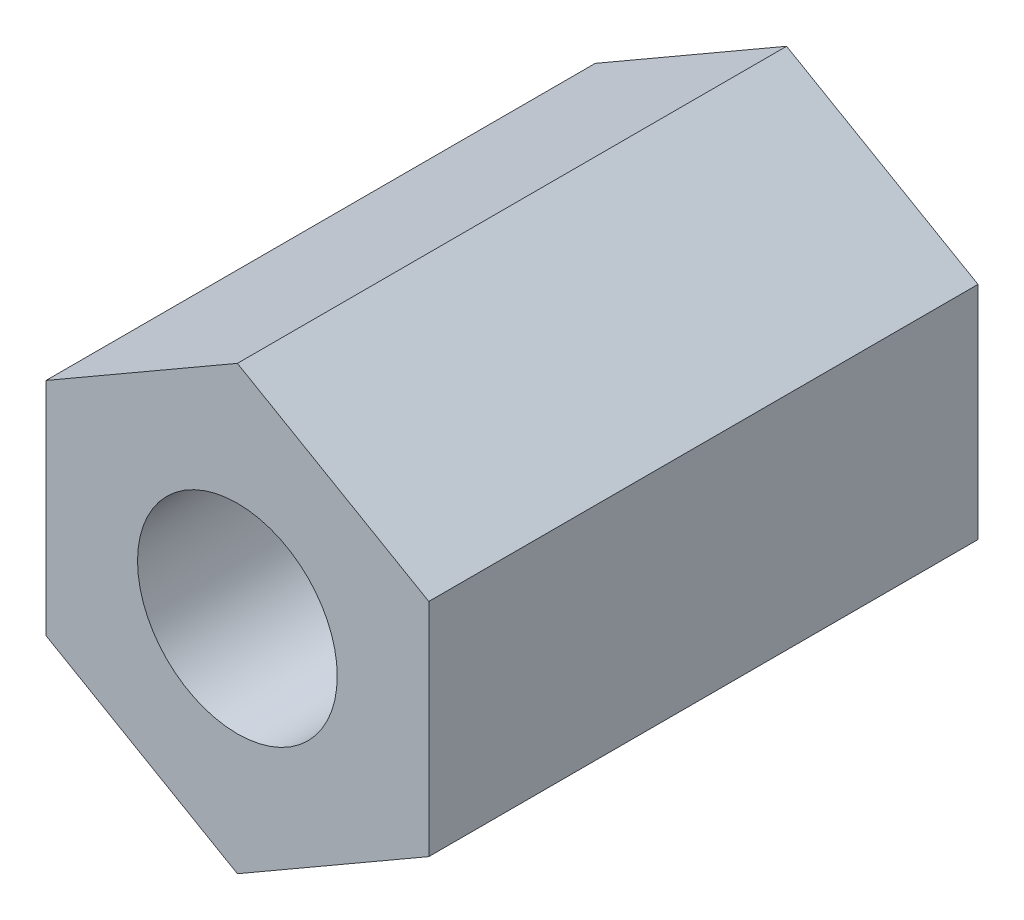
from build123d import *

# Parameters (mm, degrees)
EXTRUDE_1_DEPTH     = 66
SKETCH_12_R         = 15
CUT_EXTRUDE_3_DEPTH = 40
SKETCH_16_R         = 15
CUT_EXTRUDE_6_DEPTH = 4
CUT_EXTRUDE_6_DRAFT = -25
SKETCH_17_R         = 13.134769367
CUT_EXTRUDE_7_DEPTH = 2
CUT_EXTRUDE_7_DRAFT = -40
SKETCH_18_R         = 12
CUT_EXTRUDE_8_DEPTH = 22


with BuildPart() as part:
    # 草图2 → 拉伸1 (new body)
    with BuildSketch(Plane.XY):
        Polygon((0, 26.558112383), (-23, 13.279056191), (-23, -13.279056191), (0, -26.558112383), (23, -13.279056191), (23, 13.279056191), align=None)
    extrude(amount=EXTRUDE_1_DEPTH)

    # 草图12 → 拉伸3 (cut)
    with BuildSketch(Plane(origin=(0, 0, 0), x_dir=(-1, 0, 0), z_dir=(0, 0, -1))):
        Circle(SKETCH_12_R)
    extrude(amount=-CUT_EXTRUDE_3_DEPTH, mode=Mode.SUBTRACT)


with BuildPart() as cut_extrude_6_tool:
    # 草图16 → 拉伸6 (with draft: the straight prism first)
    with BuildSketch(Plane(origin=(0, 0, 40), x_dir=(-1, 0, 0), z_dir=(0, 0, -1))):
        Circle(SKETCH_16_R)
    extrude(amount=-CUT_EXTRUDE_6_DEPTH)
    # 拉伸6: the draft: its side faces are tilted about the plane it starts from
    cut_extrude_6_sides = [cut_extrude_6_tool.faces().sort_by_distance(p)[0] for p in [
        (15, 0, 42),
    ]]
    draft(cut_extrude_6_sides, Plane(origin=(0, 0, 40), x_dir=(-1, 0, 0), z_dir=(0, 0, -1)), CUT_EXTRUDE_6_DRAFT)


with BuildPart() as part_1:
    add(part.part)

    # 拉伸6: cut by cut_extrude_6_tool
    add(cut_extrude_6_tool.part, mode=Mode.SUBTRACT)


with BuildPart() as cut_extrude_7_tool:
    # 草图17 → 拉伸7 (with draft: the straight prism first)
    with BuildSketch(Plane(origin=(0, 0, 44), x_dir=(-1, 0, 0), z_dir=(0, 0, -1))):
        Circle(SKETCH_17_R)
    extrude(amount=-CUT_EXTRUDE_7_DEPTH)
    # 拉伸7: the draft: its side faces are tilted about the plane it starts from
    cut_extrude_7_sides = [cut_extrude_7_tool.faces().sort_by_distance(p)[0] for p in [
        (13.134769367, 0, 45),
    ]]
    draft(cut_extrude_7_sides, Plane(origin=(0, 0, 44), x_dir=(-1, 0, 0), z_dir=(0, 0, -1)), CUT_EXTRUDE_7_DRAFT)


with BuildPart() as part_2:
    add(part_1.part)

    # 拉伸7: cut by cut_extrude_7_tool
    add(cut_extrude_7_tool.part, mode=Mode.SUBTRACT)

    # 草图18 → 拉伸8 (cut)
    with BuildSketch(Plane.XY.offset(66)):
        Circle(SKETCH_18_R)
    extrude(amount=-CUT_EXTRUDE_8_DEPTH, mode=Mode.SUBTRACT)


solid = part_2.part
